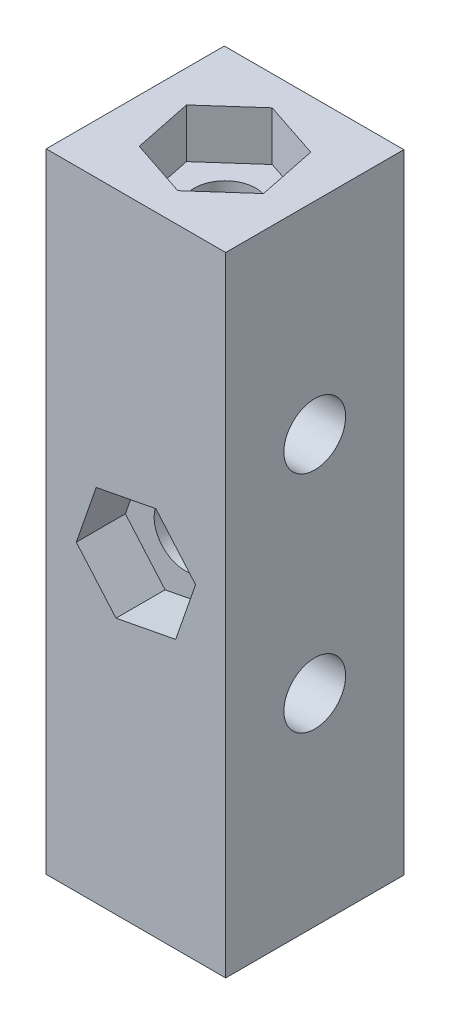
from build123d import *

# Parameters (mm, degrees)
SKETCH_1_W          = 12.8
SKETCH_1_H          = 44.8
EXTRUDE_1_DEPTH     = 12.7
SKETCH_2_R          = 2.2
CUT_EXTRUDE_1_DEPTH = 36.575886954
SKETCH_3_R          = 2.2
CUT_EXTRUDE_2_DEPTH = 33.16376457
SKETCH_4_R          = 2.2
CUT_EXTRUDE_3_DEPTH = 51.629102117
CUT_EXTRUDE_4_DEPTH = 3.5
CUT_EXTRUDE_5_DEPTH = 3.5
CUT_EXTRUDE_6_DEPTH = 3.5
CUT_EXTRUDE_7_DEPTH = 3.5


with BuildPart() as part:
    # 草圖1 → 填料-伸長1 (new body)
    with BuildSketch(Plane.XY):
        with Locations((13.474002647, -4.234146341)):
            Rectangle(SKETCH_1_W, SKETCH_1_H)
    extrude(amount=EXTRUDE_1_DEPTH)

    # 草圖2 → 除料-伸長1 (cut, through all)
    with BuildSketch(Plane.XY.offset(12.7)):
        with Locations((13.474002647, -4.234146341)):
            Circle(SKETCH_2_R)
    extrude(amount=-CUT_EXTRUDE_1_DEPTH, mode=Mode.SUBTRACT)

    # 草圖3 → 除料-伸長2 (cut, through all)
    with BuildSketch(Plane.ZY.offset(-7.074002647)):
        with Locations(Location((6.35, 3.765853659, 0), (0, 0, 270))):
            Circle(SKETCH_3_R)
        with Locations(Location((6.35, -12.234146341, 0), (0, 0, 270))):
            Circle(SKETCH_3_R)
    extrude(amount=-CUT_EXTRUDE_2_DEPTH, mode=Mode.SUBTRACT)

    # 草圖4 → 除料-伸長3 (cut, through all)
    with BuildSketch(Plane(origin=(0, 18.165853659, 0), x_dir=(1, 0, 0), z_dir=(0, 1, 0))):
        with Locations(Location((13.474002647, -6.35, 0), (0, 0, 180))):
            Circle(SKETCH_4_R)
    extrude(amount=-CUT_EXTRUDE_3_DEPTH, mode=Mode.SUBTRACT)

    # 草圖5 → 除料-伸長4 (cut)
    with BuildSketch(Plane.XY.offset(12.7)):
        Polygon((9.221190711, -5.048757069), (12.053070264, -8.324494879), (16.3058822, -7.509884151), (17.726814583, -3.419535613), (14.89493503, -0.143797803), (10.642123094, -0.958408532), align=None)
    extrude(amount=-CUT_EXTRUDE_4_DEPTH, mode=Mode.SUBTRACT)

    # 草圖6 → 除料-伸長5 (cut)
    with BuildSketch(Plane.ZY.offset(-7.074002647)):
        Polygon((9.740257522, -14.92787126), (10.377962971, -10.644959661), (6.987705449, -7.951234743), (2.959742478, -9.540421423), (2.322037029, -13.823333022), (5.712294551, -16.51705794), align=None)
        Polygon((9.740257522, 1.07212874), (10.377962971, 5.355040339), (6.987705449, 8.048765257), (2.959742478, 6.459578577), (2.322037029, 2.176666978), (5.712294551, -0.51705794), align=None)
    extrude(amount=-CUT_EXTRUDE_5_DEPTH, mode=Mode.SUBTRACT)

    # 草圖7 → 除料-伸長6 (cut)
    with BuildSketch(Plane.XZ.offset(26.634146341)):
        Polygon((17.407945653, 4.540554664), (17.007999778, 8.852171913), (13.074056771, 10.661617248), (9.540059641, 8.159445336), (9.940005516, 3.847828087), (13.873948523, 2.038382752), align=None)
    extrude(amount=-CUT_EXTRUDE_6_DEPTH, mode=Mode.SUBTRACT)

    # 草圖8 → 除料-伸長7 (cut)
    with BuildSketch(Plane(origin=(0, 18.165853659, 0), x_dir=(1, 0, 0), z_dir=(0, 1, 0))):
        Polygon((14.348050125, -10.590995285), (17.58383604, -7.713550322), (16.709788562, -3.472555037), (12.599955169, -2.109004715), (9.364169254, -4.986449678), (10.238216732, -9.227444963), align=None)
    extrude(amount=-CUT_EXTRUDE_7_DEPTH, mode=Mode.SUBTRACT)


solid = part.part
